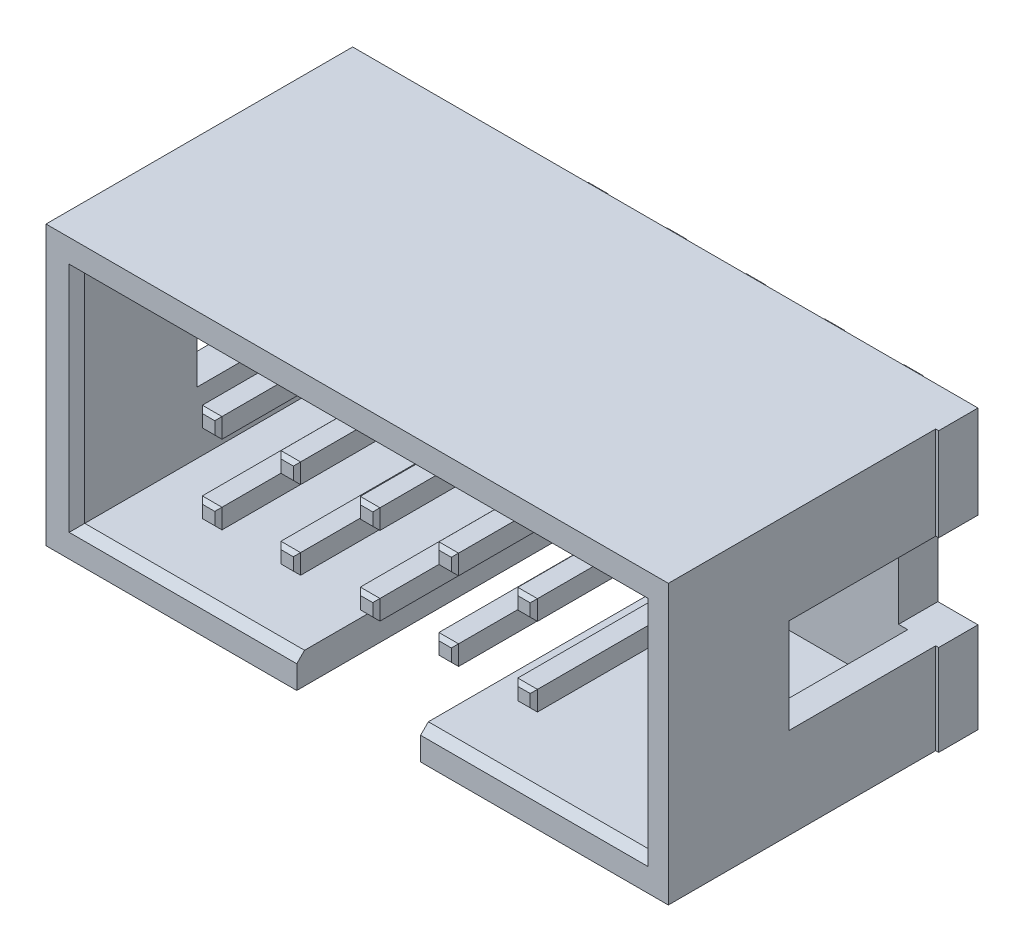
from build123d import *

# Parameters (mm, degrees)
SALIENTE_EXTRUIR1_DEPTH         = 9.652
SALIENTE_EXTRUIR1_DEPTH_BACK    = 3.048
CROQUIS1_W                      = 0.635
CROQUIS1_H                      = 0.635
SALIENTE_EXTRUIR1_2_DEPTH       = 9.652
SALIENTE_EXTRUIR1_2_DEPTH_BACK  = 3.048
SALIENTE_EXTRUIR1_3_DEPTH       = 9.652
SALIENTE_EXTRUIR1_3_DEPTH_BACK  = 3.048
SALIENTE_EXTRUIR1_4_DEPTH       = 9.652
SALIENTE_EXTRUIR1_4_DEPTH_BACK  = 3.048
SALIENTE_EXTRUIR1_5_DEPTH       = 9.652
SALIENTE_EXTRUIR1_5_DEPTH_BACK  = 3.048
SALIENTE_EXTRUIR1_6_DEPTH       = 9.652
SALIENTE_EXTRUIR1_6_DEPTH_BACK  = 3.048
SALIENTE_EXTRUIR1_7_DEPTH       = 9.652
SALIENTE_EXTRUIR1_7_DEPTH_BACK  = 3.048
SALIENTE_EXTRUIR1_8_DEPTH       = 9.652
SALIENTE_EXTRUIR1_8_DEPTH_BACK  = 3.048
SALIENTE_EXTRUIR1_9_DEPTH       = 9.652
SALIENTE_EXTRUIR1_9_DEPTH_BACK  = 3.048
SALIENTE_EXTRUIR1_10_DEPTH      = 9.652
SALIENTE_EXTRUIR1_10_DEPTH_BACK = 3.048
CHAFL_N1_SIZE                   = 0.1166114
CHAFL_N3_SIZE                   = 0.1166114
CHAFL_N4_SIZE                   = 0.1166114
CHAFL_N5_SIZE                   = 0.1166114
CHAFL_N6_SIZE                   = 0.1166114
CHAFL_N7_SIZE                   = 0.1166114
CHAFL_N8_SIZE                   = 0.1166114
CHAFL_N9_SIZE                   = 0.1166114
CHAFL_N10_SIZE                  = 0.1166114
CHAFL_N11_SIZE                  = 0.1166114
CHAFL_N12_SIZE                  = 0.1166114
CHAFL_N13_SIZE                  = 0.1166114
CHAFL_N14_SIZE                  = 0.1166114
CHAFL_N15_SIZE                  = 0.1166114
CHAFL_N16_SIZE                  = 0.1166114
CHAFL_N17_SIZE                  = 0.1166114
CHAFL_N18_SIZE                  = 0.1166114
CHAFL_N19_SIZE                  = 0.1166114
CHAFL_N20_SIZE                  = 0.1166114
CHAFL_N21_SIZE                  = 0.1166114
CROQUIS2_W                      = 20.2
CROQUIS2_H                      = 9
SALIENTE_EXTRUIR2_DEPTH         = 1.27
SALIENTE_EXTRUIR4_DEPTH         = 8.636
CROQUIS4_W                      = 4
CROQUIS4_H                      = 1
CORTAR_EXTRUIR1_DEPTH           = 8.9408
CHAFL_N22_SIZE                  = 0.251714
CROQUIS6_W                      = 6.007861491
CROQUIS6_H                      = 3.065975322
CORTAR_EXTRUIR2_DEPTH           = 1.2
CROQUIS7_W                      = 1.27
CROQUIS7_H                      = 3.067844188
CORTAR_EXTRUIR3_DEPTH           = 1.2
CROQUIS8_W                      = 6.035209394
CROQUIS8_H                      = 3.002324431
CORTAR_EXTRUIR4_DEPTH           = 1.2


with BuildPart() as part:
    # Croquis1 → Saliente-Extruir1 (new, two sides: drawn at the far end of the back side and taken through both)
    with BuildSketch(Plane.XY.offset(-SALIENTE_EXTRUIR1_DEPTH_BACK)):
        Rectangle(CROQUIS1_W, CROQUIS1_H)
    extrude(amount=SALIENTE_EXTRUIR1_DEPTH + SALIENTE_EXTRUIR1_DEPTH_BACK)

    # Chaflán20
    chafl_n20_edges = [part.edges().sort_by_distance(p)[0] for p in [
        (0.3175, 0, -3.048),
        (0, 0.3175, -3.048),
        (-0.3175, 0, -3.048),
        (0, -0.3175, -3.048),
    ]]
    chamfer(chafl_n20_edges, length=CHAFL_N20_SIZE)

    # Chaflán21
    chafl_n21_edges = [part.edges().sort_by_distance(p)[0] for p in [
        (-0.3175, 0, 9.652),
        (0, -0.3175, 9.652),
        (0.3175, 0, 9.652),
        (0, 0.3175, 9.652),
    ]]
    chamfer(chafl_n21_edges, length=CHAFL_N21_SIZE)



with BuildPart() as body_2:
    # Croquis1 → Saliente-Extruir1 2 (new, two sides: drawn at the far end of the back side and taken through both)
    with BuildSketch(Plane.XY.offset(-SALIENTE_EXTRUIR1_2_DEPTH_BACK)):
        with Locations((2.53873581, 0)):
            Rectangle(CROQUIS1_W, CROQUIS1_H)
    extrude(amount=SALIENTE_EXTRUIR1_2_DEPTH + SALIENTE_EXTRUIR1_2_DEPTH_BACK)

    # Chaflán1
    chafl_n1_edges = [body_2.edges().sort_by_distance(p)[0] for p in [
        (2.53873581, -0.3175, 9.652),
        (2.85623581, 0, 9.652),
        (2.53873581, 0.3175, 9.652),
        (2.22123581, 0, 9.652),
    ]]
    chamfer(chafl_n1_edges, length=CHAFL_N1_SIZE)

    # Chaflán19
    chafl_n19_edges = [body_2.edges().sort_by_distance(p)[0] for p in [
        (2.53873581, 0.3175, -3.048),
        (2.22123581, 0, -3.048),
        (2.53873581, -0.3175, -3.048),
        (2.85623581, 0, -3.048),
    ]]
    chamfer(chafl_n19_edges, length=CHAFL_N19_SIZE)


with BuildPart() as body_3:
    # Croquis1 → Saliente-Extruir1 3 (new, two sides: drawn at the far end of the back side and taken through both)
    with BuildSketch(Plane.XY.offset(-SALIENTE_EXTRUIR1_3_DEPTH_BACK)):
        with Locations((5.103331066, 0)):
            Rectangle(CROQUIS1_W, CROQUIS1_H)
    extrude(amount=SALIENTE_EXTRUIR1_3_DEPTH + SALIENTE_EXTRUIR1_3_DEPTH_BACK)

    # Chaflán6
    chafl_n6_edges = [body_3.edges().sort_by_distance(p)[0] for p in [
        (5.420831066, 0, 9.652),
        (5.103331066, 0.3175, 9.652),
        (4.785831066, 0, 9.652),
        (5.103331066, -0.3175, 9.652),
    ]]
    chamfer(chafl_n6_edges, length=CHAFL_N6_SIZE)

    # Chaflán18
    chafl_n18_edges = [body_3.edges().sort_by_distance(p)[0] for p in [
        (4.785831066, 0, -3.048),
        (5.103331066, -0.3175, -3.048),
        (5.420831066, 0, -3.048),
        (5.103331066, 0.3175, -3.048),
    ]]
    chamfer(chafl_n18_edges, length=CHAFL_N18_SIZE)


with BuildPart() as body_4:
    # Croquis1 → Saliente-Extruir1 4 (new, two sides: drawn at the far end of the back side and taken through both)
    with BuildSketch(Plane.XY.offset(-SALIENTE_EXTRUIR1_4_DEPTH_BACK)):
        with Locations((7.642066877, 0)):
            Rectangle(CROQUIS1_W, CROQUIS1_H)
    extrude(amount=SALIENTE_EXTRUIR1_4_DEPTH + SALIENTE_EXTRUIR1_4_DEPTH_BACK)

    # Chaflán7
    chafl_n7_edges = [body_4.edges().sort_by_distance(p)[0] for p in [
        (7.324566877, 0, 9.652),
        (7.642066877, -0.3175, 9.652),
        (7.959566877, 0, 9.652),
        (7.642066877, 0.3175, 9.652),
    ]]
    chamfer(chafl_n7_edges, length=CHAFL_N7_SIZE)

    # Chaflán17
    chafl_n17_edges = [body_4.edges().sort_by_distance(p)[0] for p in [
        (7.959566877, 0, -3.048),
        (7.642066877, 0.3175, -3.048),
        (7.324566877, 0, -3.048),
        (7.642066877, -0.3175, -3.048),
    ]]
    chamfer(chafl_n17_edges, length=CHAFL_N17_SIZE)


with BuildPart() as body_5:
    # Croquis1 → Saliente-Extruir1 5 (new, two sides: drawn at the far end of the back side and taken through both)
    with BuildSketch(Plane.XY.offset(-SALIENTE_EXTRUIR1_5_DEPTH_BACK)):
        with Locations((10.190341793, 0)):
            Rectangle(CROQUIS1_W, CROQUIS1_H)
    extrude(amount=SALIENTE_EXTRUIR1_5_DEPTH + SALIENTE_EXTRUIR1_5_DEPTH_BACK)

    # Chaflán9
    chafl_n9_edges = [body_5.edges().sort_by_distance(p)[0] for p in [
        (10.507841793, 0, 9.652),
        (10.190341793, 0.3175, 9.652),
        (9.872841793, 0, 9.652),
        (10.190341793, -0.3175, 9.652),
    ]]
    chamfer(chafl_n9_edges, length=CHAFL_N9_SIZE)

    # Chaflán16
    chafl_n16_edges = [body_5.edges().sort_by_distance(p)[0] for p in [
        (9.872841793, 0, -3.048),
        (10.190341793, -0.3175, -3.048),
        (10.507841793, 0, -3.048),
        (10.190341793, 0.3175, -3.048),
    ]]
    chamfer(chafl_n16_edges, length=CHAFL_N16_SIZE)


with BuildPart() as body_6:
    # Croquis1 → Saliente-Extruir1 6 (new, two sides: drawn at the far end of the back side and taken through both)
    with BuildSketch(Plane.XY.offset(-SALIENTE_EXTRUIR1_6_DEPTH_BACK)):
        with Locations((10.190341793, -2.536922893)):
            Rectangle(CROQUIS1_W, CROQUIS1_H)
    extrude(amount=SALIENTE_EXTRUIR1_6_DEPTH + SALIENTE_EXTRUIR1_6_DEPTH_BACK)

    # Chaflán10
    chafl_n10_edges = [body_6.edges().sort_by_distance(p)[0] for p in [
        (10.507841793, -2.536922893, 9.652),
        (10.190341793, -2.219422893, 9.652),
        (9.872841793, -2.536922893, 9.652),
        (10.190341793, -2.854422893, 9.652),
    ]]
    chamfer(chafl_n10_edges, length=CHAFL_N10_SIZE)

    # Chaflán11
    chafl_n11_edges = [body_6.edges().sort_by_distance(p)[0] for p in [
        (9.872841793, -2.536922893, -3.048),
        (10.190341793, -2.854422893, -3.048),
        (10.507841793, -2.536922893, -3.048),
        (10.190341793, -2.219422893, -3.048),
    ]]
    chamfer(chafl_n11_edges, length=CHAFL_N11_SIZE)


with BuildPart() as body_7:
    # Croquis1 → Saliente-Extruir1 7 (new, two sides: drawn at the far end of the back side and taken through both)
    with BuildSketch(Plane.XY.offset(-SALIENTE_EXTRUIR1_7_DEPTH_BACK)):
        with Locations((7.642066877, -2.536922893)):
            Rectangle(CROQUIS1_W, CROQUIS1_H)
    extrude(amount=SALIENTE_EXTRUIR1_7_DEPTH + SALIENTE_EXTRUIR1_7_DEPTH_BACK)

    # Chaflán8
    chafl_n8_edges = [body_7.edges().sort_by_distance(p)[0] for p in [
        (7.324566877, -2.536922893, 9.652),
        (7.642066877, -2.854422893, 9.652),
        (7.959566877, -2.536922893, 9.652),
        (7.642066877, -2.219422893, 9.652),
    ]]
    chamfer(chafl_n8_edges, length=CHAFL_N8_SIZE)

    # Chaflán12
    chafl_n12_edges = [body_7.edges().sort_by_distance(p)[0] for p in [
        (7.959566877, -2.536922893, -3.048),
        (7.642066877, -2.219422893, -3.048),
        (7.324566877, -2.536922893, -3.048),
        (7.642066877, -2.854422893, -3.048),
    ]]
    chamfer(chafl_n12_edges, length=CHAFL_N12_SIZE)


with BuildPart() as body_8:
    # Croquis1 → Saliente-Extruir1 8 (new, two sides: drawn at the far end of the back side and taken through both)
    with BuildSketch(Plane.XY.offset(-SALIENTE_EXTRUIR1_8_DEPTH_BACK)):
        with Locations((5.103331066, -2.536922893)):
            Rectangle(CROQUIS1_W, CROQUIS1_H)
    extrude(amount=SALIENTE_EXTRUIR1_8_DEPTH + SALIENTE_EXTRUIR1_8_DEPTH_BACK)

    # Chaflán5
    chafl_n5_edges = [body_8.edges().sort_by_distance(p)[0] for p in [
        (5.103331066, -2.219422893, 9.652),
        (4.785831066, -2.536922893, 9.652),
        (5.103331066, -2.854422893, 9.652),
        (5.420831066, -2.536922893, 9.652),
    ]]
    chamfer(chafl_n5_edges, length=CHAFL_N5_SIZE)

    # Chaflán13
    chafl_n13_edges = [body_8.edges().sort_by_distance(p)[0] for p in [
        (5.103331066, -2.854422893, -3.048),
        (5.420831066, -2.536922893, -3.048),
        (5.103331066, -2.219422893, -3.048),
        (4.785831066, -2.536922893, -3.048),
    ]]
    chamfer(chafl_n13_edges, length=CHAFL_N13_SIZE)


with BuildPart() as body_9:
    # Croquis1 → Saliente-Extruir1 9 (new, two sides: drawn at the far end of the back side and taken through both)
    with BuildSketch(Plane.XY.offset(-SALIENTE_EXTRUIR1_9_DEPTH_BACK)):
        with Locations((2.53873581, -2.536922893)):
            Rectangle(CROQUIS1_W, CROQUIS1_H)
    extrude(amount=SALIENTE_EXTRUIR1_9_DEPTH + SALIENTE_EXTRUIR1_9_DEPTH_BACK)

    # Chaflán4
    chafl_n4_edges = [body_9.edges().sort_by_distance(p)[0] for p in [
        (2.22123581, -2.536922893, 9.652),
        (2.53873581, -2.854422893, 9.652),
        (2.85623581, -2.536922893, 9.652),
        (2.53873581, -2.219422893, 9.652),
    ]]
    chamfer(chafl_n4_edges, length=CHAFL_N4_SIZE)

    # Chaflán14
    chafl_n14_edges = [body_9.edges().sort_by_distance(p)[0] for p in [
        (2.85623581, -2.536922893, -3.048),
        (2.53873581, -2.219422893, -3.048),
        (2.22123581, -2.536922893, -3.048),
        (2.53873581, -2.854422893, -3.048),
    ]]
    chamfer(chafl_n14_edges, length=CHAFL_N14_SIZE)


with BuildPart() as body_10:
    # Croquis1 → Saliente-Extruir1 10 (new, two sides: drawn at the far end of the back side and taken through both)
    with BuildSketch(Plane.XY.offset(-SALIENTE_EXTRUIR1_10_DEPTH_BACK)):
        with Locations((0, -2.536922893)):
            Rectangle(CROQUIS1_W, CROQUIS1_H)
    extrude(amount=SALIENTE_EXTRUIR1_10_DEPTH + SALIENTE_EXTRUIR1_10_DEPTH_BACK)

    # Chaflán3
    chafl_n3_edges = [body_10.edges().sort_by_distance(p)[0] for p in [
        (0.3175, -2.536922893, 9.652),
        (0, -2.219422893, 9.652),
        (-0.3175, -2.536922893, 9.652),
        (0, -2.854422893, 9.652),
    ]]
    chamfer(chafl_n3_edges, length=CHAFL_N3_SIZE)

    # Chaflán15
    chafl_n15_edges = [body_10.edges().sort_by_distance(p)[0] for p in [
        (-0.3175, -2.536922893, -3.048),
        (0, -2.854422893, -3.048),
        (0.3175, -2.536922893, -3.048),
        (0, -2.219422893, -3.048),
    ]]
    chamfer(chafl_n15_edges, length=CHAFL_N15_SIZE)


with BuildPart() as part_1:
    add(part.part)

    add(body_2.part)  # Saliente-Extruir2 merges body 2

    add(body_3.part)  # Saliente-Extruir2 merges body 3

    add(body_4.part)  # Saliente-Extruir2 merges body 4

    add(body_5.part)  # Saliente-Extruir2 merges body 5

    add(body_6.part)  # Saliente-Extruir2 merges body 6

    add(body_7.part)  # Saliente-Extruir2 merges body 7

    add(body_8.part)  # Saliente-Extruir2 merges body 8

    add(body_9.part)  # Saliente-Extruir2 merges body 9

    add(body_10.part)  # Saliente-Extruir2 merges body 10
    # Croquis2 → Saliente-Extruir2 (add)
    with BuildSketch(Plane.XY):
        with Locations((5.103331066, -1.268461447)):
            Rectangle(CROQUIS2_W, CROQUIS2_H)
    extrude(amount=SALIENTE_EXTRUIR2_DEPTH)

    # Croquis3 → Saliente-Extruir4 (add)
    with BuildSketch(Plane.XY.offset(1.27)):
        Polygon((-4.996668934, -5.768461447), (4.897746819, -5.768461447), (4.897746819, -4.768461447), (-3.996668934, -4.768461447), (-3.996668934, 2.231538553), (14.203331066, 2.231538553), (14.203331066, -4.768461447), (13.965354916, -4.768461447), (5.46843544, -4.768461447), (5.46843544, -5.768461447), (15.106732159, -5.768461447), (15.106732159, 3.231538553), (-4.996668934, 3.231538553), align=None)
    extrude(amount=SALIENTE_EXTRUIR4_DEPTH)

    # Croquis4 → Cortar-Extruir1 (cut)
    with BuildSketch(Plane.XY.offset(9.906)):
        with Locations((5.103331066, -5.268461447)):
            Rectangle(CROQUIS4_W, CROQUIS4_H)
    extrude(amount=-CORTAR_EXTRUIR1_DEPTH, mode=Mode.SUBTRACT)

    # Chaflán22
    chafl_n22_edges = [part_1.edges().sort_by_distance(p)[0] for p in [
        (-0.446668934, -4.768461447, 9.906),
        (-3.996668934, -1.268461447, 9.906),
        (5.103331066, 2.231538553, 9.906),
        (14.203331066, -1.268461447, 9.906),
        (10.653331066, -4.768461447, 9.906),
    ]]
    chamfer(chafl_n22_edges, length=CHAFL_N22_SIZE)

    # Croquis6 → Cortar-Extruir2 (cut)
    with BuildSketch(Plane(origin=(15.106732159, 0, 0), x_dir=(0, 0, -1), z_dir=(1, 0, 0))):
        with Locations((-3.003930746, -1.300741699)):
            Rectangle(CROQUIS6_W, CROQUIS6_H)
    extrude(amount=-CORTAR_EXTRUIR2_DEPTH, mode=Mode.SUBTRACT)

    # Croquis7 → Cortar-Extruir3 (cut)
    with BuildSketch(Plane(origin=(15.203331066, 0, 0), x_dir=(0, 0, -1), z_dir=(1, 0, 0))):
        with Locations((-0.635, -1.299807266)):
            Rectangle(CROQUIS7_W, CROQUIS7_H)
    extrude(amount=-CORTAR_EXTRUIR3_DEPTH, mode=Mode.SUBTRACT)

    # Croquis8 → Cortar-Extruir4 (cut)
    with BuildSketch(Plane.ZY.offset(4.996668934)):
        with Locations((3.017604697, -1.268461447)):
            Rectangle(CROQUIS8_W, CROQUIS8_H)
    extrude(amount=-CORTAR_EXTRUIR4_DEPTH, mode=Mode.SUBTRACT)


solid = part_1.part
